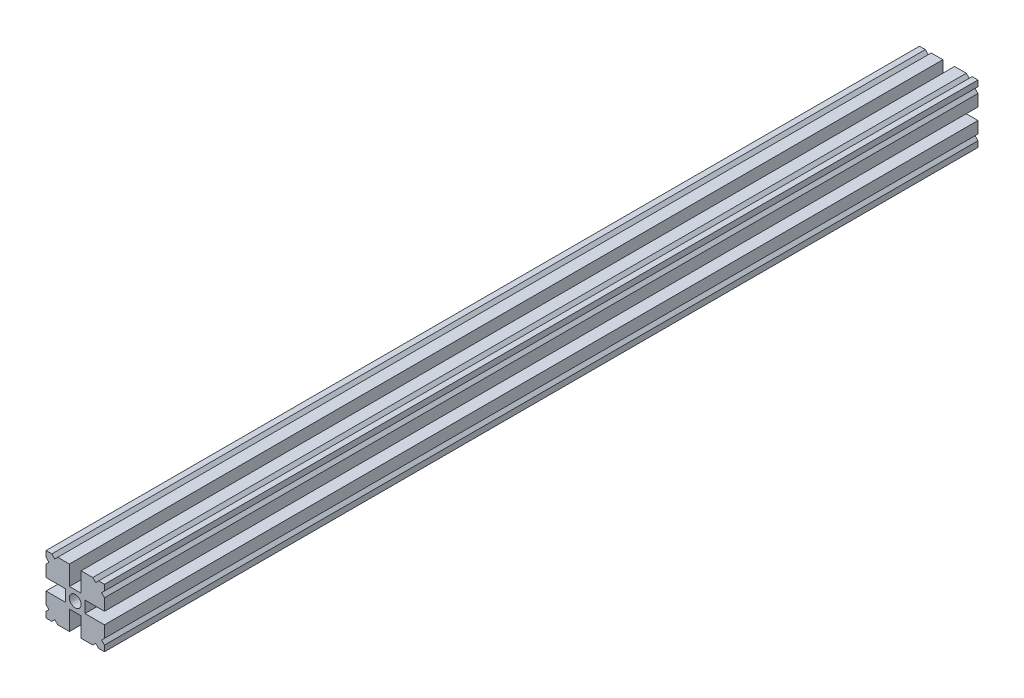
from build123d import *

# Parameters (mm, degrees)
SKETCH1_R           = 1.5
BOSS_EXTRUDE1_DEPTH = 224


with BuildPart() as part:
    # Sketch1 → Boss-Extrude1 (new body)
    with BuildSketch(Plane.XY):
        Polygon((-7.5, 7.5), (-6, 7.5), (-5.25, 6.75), (-4.5, 7.5), (-1.5, 7.5), (-1.5, 2.5), (1.5, 2.5), (1.5, 7.5), (4.5, 7.5), (5.25, 6.75), (6, 7.5), (7.5, 7.5), (7.5, 6), (6.75, 5.25), (7.5, 4.5), (7.5, 1.5), (2.5, 1.5), (2.5, -1.5), (7.5, -1.5), (7.5, -4.5), (6.75, -5.25), (7.5, -6), (7.5, -7.5), (6, -7.5), (5.25, -6.75), (4.5, -7.5), (1.5, -7.5), (1.5, -2.5), (-1.5, -2.5), (-1.5, -7.5), (-4.5, -7.5), (-5.25, -6.75), (-6, -7.5), (-7.5, -7.5), (-7.5, -6), (-6.75, -5.25), (-7.5, -4.5), (-7.5, -1.5), (-2.5, -1.5), (-2.5, 1.5), (-7.5, 1.5), (-7.5, 4.5), (-6.75, 5.25), (-7.5, 6), align=None)
        Circle(SKETCH1_R, mode=Mode.SUBTRACT)
    extrude(amount=BOSS_EXTRUDE1_DEPTH)


solid = part.part
